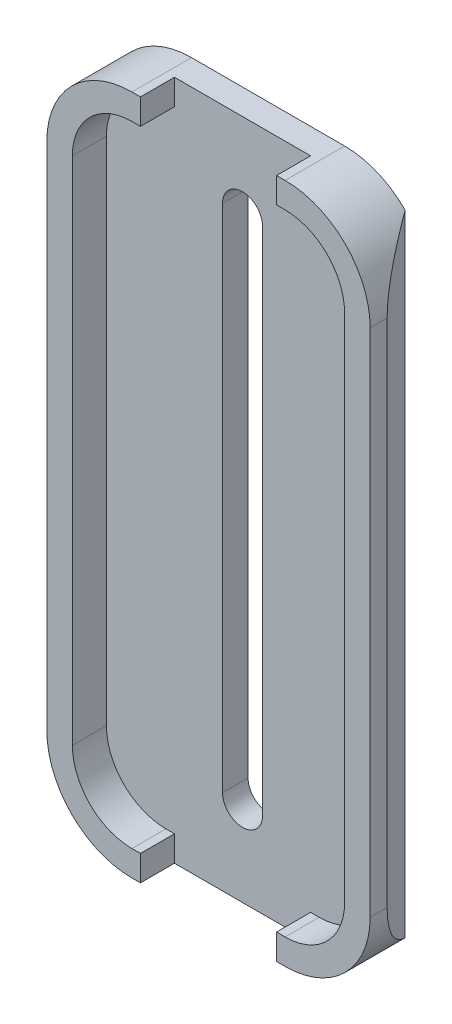
from build123d import *

# Parameters (mm, degrees)
EXTRUDE_1_DEPTH     = 80
FILLET_1_R          = 10
CUT_EXTRUDE_1_DEPTH = 4
SKETCH_3_W          = 16
SKETCH_3_H          = 3
CUT_EXTRUDE_2_DEPTH = 4
CUT_EXTRUDE_3_REACH = 90.843
SKETCH_5_W          = 8
SKETCH_5_H          = 70
CUT_EXTRUDE_4_DEPTH = 1
FILLET_2_R          = 2


with BuildPart() as part:
    # Эскиз1 → Бобышка-Вытянуть1 (new body)
    with BuildSketch(Plane(origin=(0, 0, 0), x_dir=(1, 0, 0), z_dir=(0, 1, 0))):
        Polygon((0, 0), (-38, 0), (-38, 2), (-35.113248654, 7), (-2.886751346, 7), (0, 2), align=None)
    extrude(amount=EXTRUDE_1_DEPTH)

    # Скругление1
    fillet_1_edges = [part.edges().sort_by_distance(p)[0] for p in [
        (0, 0, -1),
        (-38, 0, -1),
        (-38, 80, -1),
        (0, 80, -1),
    ]]
    fillet(fillet_1_edges, radius=FILLET_1_R)

    # Эскиз2 → Вырез-Вытянуть1 (cut)
    with BuildSketch(Plane.XY):
        with BuildLine():
            Line((-28, 3), (-10, 3))
            ThreePointArc((-10, 3), (-5.050252532, 5.050252532), (-3, 10))
            Line((-3, 10), (-3, 70))
            ThreePointArc((-3, 70), (-5.050252532, 74.949747468), (-10, 77))
            Line((-10, 77), (-28, 77))
            ThreePointArc((-28, 77), (-32.949747468, 74.949747468), (-35, 70))
            Line((-35, 70), (-35, 10))
            ThreePointArc((-35, 10), (-32.949747468, 5.050252532), (-28, 3))
        make_face()
    extrude(amount=-CUT_EXTRUDE_1_DEPTH, mode=Mode.SUBTRACT)

    # Эскиз3 → Вырез-Вытянуть2 (cut)
    with BuildSketch(Plane.XY):
        with Locations((-19, 78.5)):
            Rectangle(SKETCH_3_W, SKETCH_3_H)
        with Locations((-19, 1.5)):
            Rectangle(SKETCH_3_W, SKETCH_3_H)
    extrude(amount=-CUT_EXTRUDE_2_DEPTH, mode=Mode.SUBTRACT)

    # Эскиз4 → Вырез-Вытянуть3 (cut, up to next)
    with BuildSketch(Plane(origin=(0, 0, -7), x_dir=(-1, 0, 0), z_dir=(0, 0, -1)), mode=Mode.PRIVATE) as cut_extrude_3_sk1:
        with BuildLine():
            Line((21.35, 70), (21.35, 10))
            ThreePointArc((21.35, 10), (19, 7.65), (16.65, 10))
            Line((16.65, 10), (16.65, 70))
            ThreePointArc((16.65, 70), (19, 72.35), (21.35, 70))
        make_face()
    cut_extrude_3_tool1 = extrude(cut_extrude_3_sk1.sketch, amount=-CUT_EXTRUDE_3_REACH, mode=Mode.PRIVATE) & part.part
    add(cut_extrude_3_tool1.solids().sort_by_distance((-19, 40, -7))[0], mode=Mode.SUBTRACT)

    # Эскиз5 → Вырез-Вытянуть4 (cut)
    with BuildSketch(Plane(origin=(0, 0, -7), x_dir=(-1, 0, 0), z_dir=(0, 0, -1))):
        with Locations((9.768375673, 40)):
            Rectangle(SKETCH_5_W, SKETCH_5_H)
        with Locations((28.231624327, 40)):
            Rectangle(SKETCH_5_W, SKETCH_5_H)
    extrude(amount=-CUT_EXTRUDE_4_DEPTH, mode=Mode.SUBTRACT)

    # Скругление2
    fillet_2_edges = [part.edges().sort_by_distance(p)[0] for p in [
        (-13.768375673, 75, -6.5),
        (-13.768375673, 5, -6.5),
        (-5.768375673, 5, -6.5),
        (-5.768375673, 75, -6.5),
        (-32.231624327, 75, -6.5),
        (-32.231624327, 5, -6.5),
        (-24.231624327, 5, -6.5),
        (-24.231624327, 75, -6.5),
    ]]
    fillet(fillet_2_edges, radius=FILLET_2_R)


solid = part.part
